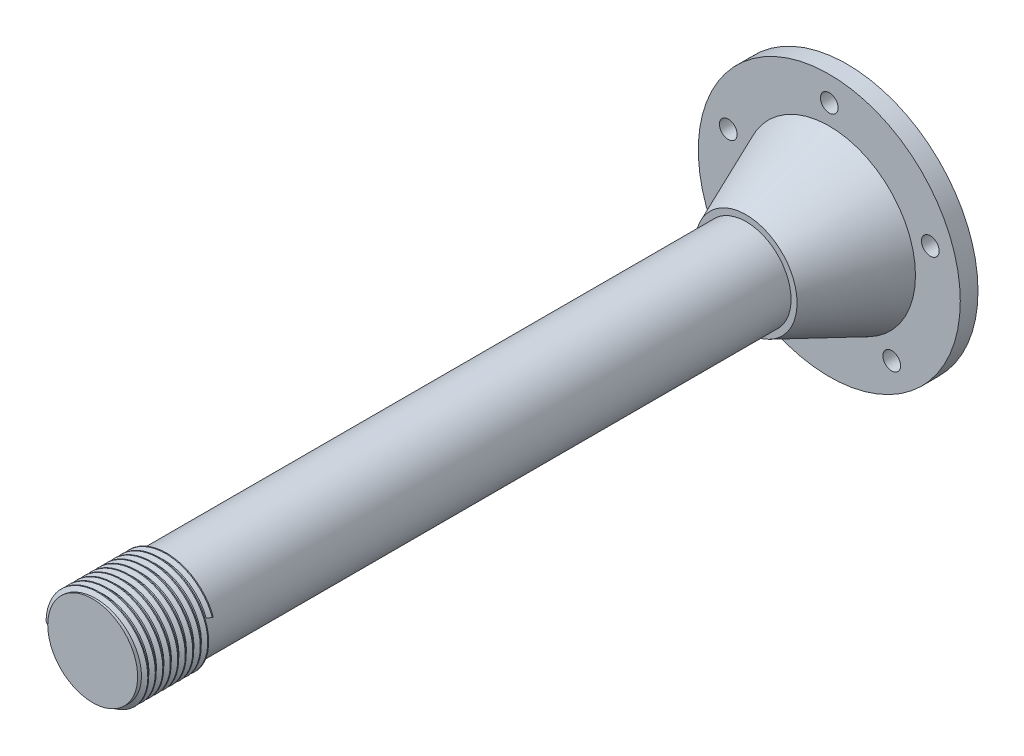
from build123d import *

# Parameters (mm, degrees)
SKETCH1_R           = 37
SKETCH1_R_2         = 2.5
BOSS_EXTRUDE1_DEPTH = 2.5
SKETCH2_R           = 25.4
BOSS_EXTRUDE2_DEPTH = 26
BOSS_EXTRUDE2_TAPER = 22.94456
SKETCH3_R           = 12.7
BOSS_EXTRUDE3_DEPTH = 184.55
THREAD1_PITCH       = 2.116666667
THREAD1_HEIGHT      = 20
THREAD1_RADIUS      = 12.7


with BuildPart() as part:
    # Sketch1 → Boss-Extrude1 (new, symmetric)
    with BuildSketch(Plane.XY):
        Circle(SKETCH1_R)
        with Locations((0, 30)):
            Circle(SKETCH1_R_2, mode=Mode.SUBTRACT)
        with Locations((28.531695489, 9.270509831)):
            Circle(SKETCH1_R_2, mode=Mode.SUBTRACT)
        with Locations((17.633557569, -24.270509831)):
            Circle(SKETCH1_R_2, mode=Mode.SUBTRACT)
        with Locations((-17.633557569, -24.270509831)):
            Circle(SKETCH1_R_2, mode=Mode.SUBTRACT)
        with Locations((-28.531695489, 9.270509831)):
            Circle(SKETCH1_R_2, mode=Mode.SUBTRACT)
    extrude(amount=BOSS_EXTRUDE1_DEPTH, both=True)

    # Sketch2 → Boss-Extrude2 (add)
    with BuildSketch(Plane.XY):
        Circle(SKETCH2_R)
    extrude(amount=BOSS_EXTRUDE2_DEPTH, taper=BOSS_EXTRUDE2_TAPER)

    # Sketch3 → Boss-Extrude3 (add)
    with BuildSketch(Plane.XY.offset(26)):
        Circle(SKETCH3_R)
    extrude(amount=BOSS_EXTRUDE3_DEPTH)

    # Thread1: sweep along a helix
    with BuildLine() as thread1_path:
        Helix(THREAD1_PITCH, THREAD1_HEIGHT, THREAD1_RADIUS, center=(0, 0, 210.55), direction=(0, 0, -1))
    # Thread Profile1 → Thread1 (sweep)
    with BuildSketch(Plane(origin=(-12.7, 0, 210.55), x_dir=(-1, 0, 0), z_dir=(0, -1, 0))):
        Polygon((0, 0), (1.145679435, 0.66145833), (1.145679435, 0.926041664), (0, 1.587499994), align=None)
    sweep(path=thread1_path.line, is_frenet=True)


solid = part.part
